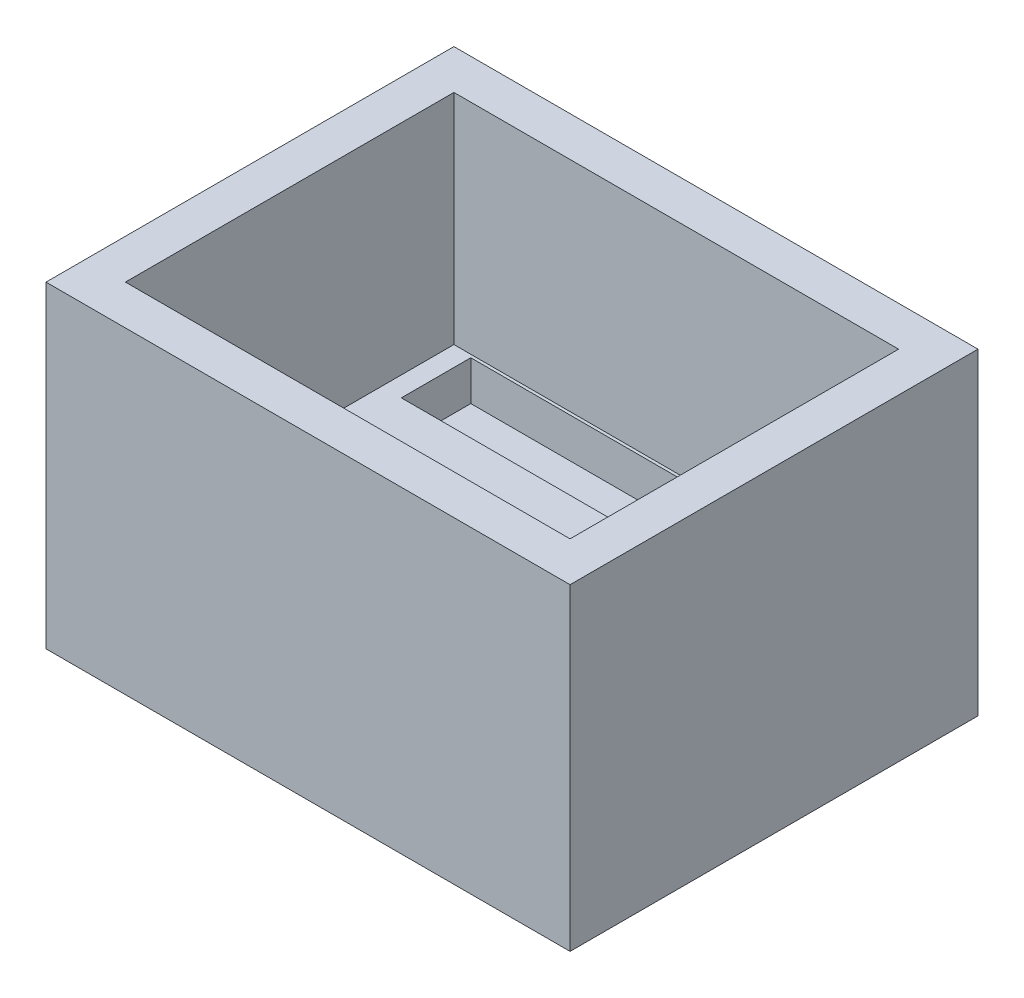
from build123d import *

# Parameters (mm, degrees)
SKETCH1_W           = 20.4
SKETCH1_H           = 16.55
SKETCH1_R           = 1.55
SKETCH1_W_2         = 1
BOSS_EXTRUDE1_DEPTH = 5
SKETCH2_W           = 20.4
SKETCH2_H           = 3.5
CUT_EXTRUDE1_DEPTH  = 2
SKETCH3_W           = 26.4
SKETCH3_H           = 20.55
SKETCH3_W_2         = 22.4
SKETCH3_H_2         = 16.55
BOSS_EXTRUDE2_DEPTH = 16


with BuildPart() as part:
    # Sketch1 → Boss-Extrude1 (new body)
    # profile 1 of 3: a face of its own
    with BuildSketch(Plane(origin=(0, 0, 0), x_dir=(1, 0, 0), z_dir=(0, 1, 0))):
        Rectangle(SKETCH1_W, SKETCH1_H)
        with Locations(Location((-7.65, -5.525, 0), (0, 0, 270))):
            Circle(SKETCH1_R, mode=Mode.SUBTRACT)
        with Locations(Location((7.65, -5.525, 0), (0, 0, 270))):
            Circle(SKETCH1_R, mode=Mode.SUBTRACT)
    # profile 2 of 3: a face of its own
    with BuildSketch(Plane(origin=(0, 0, 0), x_dir=(1, 0, 0), z_dir=(0, 1, 0))):
        with Locations((-10.7, 0)):
            Rectangle(SKETCH1_W_2, SKETCH1_H)
    # profile 3 of 3: a face of its own
    with BuildSketch(Plane(origin=(0, 0, 0), x_dir=(1, 0, 0), z_dir=(0, 1, 0))):
        with Locations((10.7, 0)):
            Rectangle(SKETCH1_W_2, SKETCH1_H)
    extrude(amount=BOSS_EXTRUDE1_DEPTH)

    # Sketch2 → Cut-Extrude1 (cut)
    with BuildSketch(Plane(origin=(0, 5, 0), x_dir=(1, 0, 0), z_dir=(0, 1, 0))):
        with Locations((0, 6.375)):
            Rectangle(SKETCH2_W, SKETCH2_H)
    extrude(amount=-CUT_EXTRUDE1_DEPTH, mode=Mode.SUBTRACT)

    # Sketch3 → Boss-Extrude2 (add)
    with BuildSketch(Plane.XZ):
        Rectangle(SKETCH3_W, SKETCH3_H)
        Rectangle(SKETCH3_W_2, SKETCH3_H_2, mode=Mode.SUBTRACT)
    extrude(amount=-BOSS_EXTRUDE2_DEPTH)


solid = part.part
